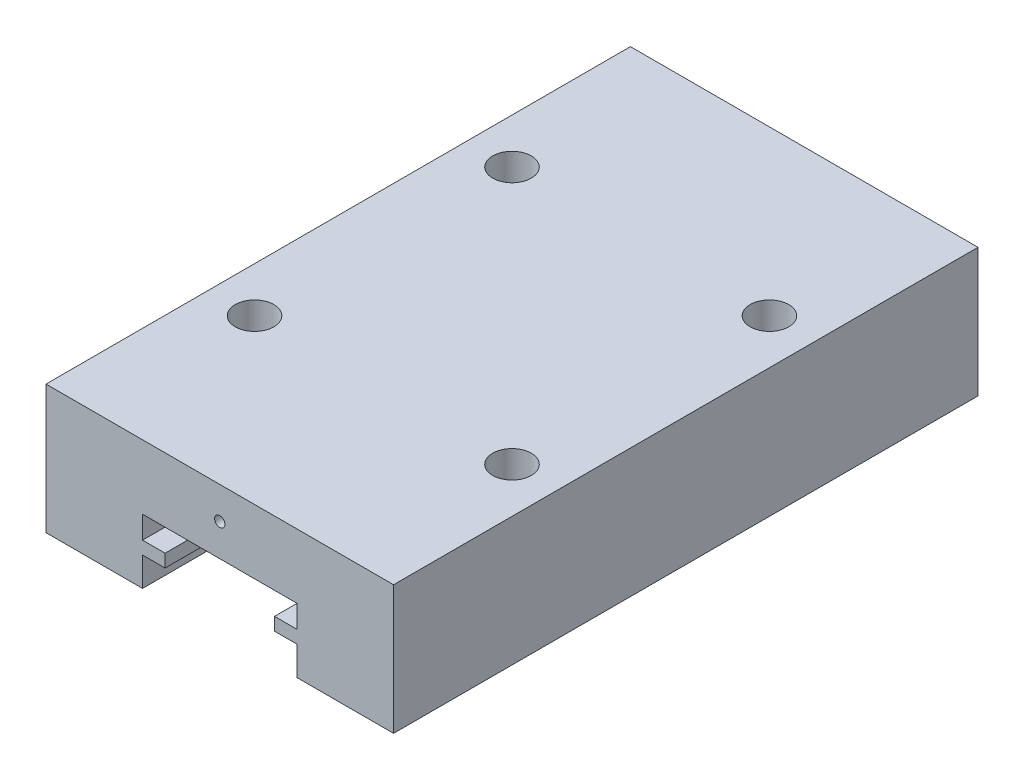
from build123d import *

# Parameters (mm, degrees)
DODANIE_WYCI_GNI_CIE1_DEPTH    = 45.4
OTWORY_USTALAJ_CE_1_0MM1_D     = 0.8
OTWORY_USTALAJ_CE_1_0MM1_DEPTH = 6.5
OTWORY_USTALAJ_CE_1_0MM1_TIP   = 0.240344248
OTWORY_USTALAJ_CE_1_0MM2_D     = 0.8
OTWORY_USTALAJ_CE_1_0MM2_DEPTH = 6.5
OTWORY_USTALAJ_CE_1_0MM2_TIP   = 0.240344248
F_3_0MM_DOWEL_HOLE1_D          = 3
F_3_0MM_DOWEL_HOLE1_DEPTH      = 3.5


with BuildPart() as part:
    # Szkic1 → Dodanie-wyciągnięcie1 (new body)
    with BuildSketch(Plane.XY):
        Polygon((7.5, 0), (7.5, 2.247882756), (9.25, 2.247882756), (9.25, 3.247882756), (7.5, 3.247882756), (7.5, 4.997882756), (19.5, 4.997882756), (19.5, 3.247882756), (17.75, 3.247882756), (17.75, 2.247882756), (19.5, 2.247882756), (19.5, 0), (27, 0), (27, 10), (0, 10), (0, 0), align=None)
    extrude(amount=DODANIE_WYCI_GNI_CIE1_DEPTH)

    # Otwory ustalające Ø1.0mm1
    with Locations(Plane.XY.offset(45.4)):
        with Locations((13.5, 7.5)):
            Hole(OTWORY_USTALAJ_CE_1_0MM1_D / 2, depth=OTWORY_USTALAJ_CE_1_0MM1_DEPTH)
            with Locations((0, 0, -(OTWORY_USTALAJ_CE_1_0MM1_DEPTH + OTWORY_USTALAJ_CE_1_0MM1_TIP / 2))):  # 118° drill point
                Cone(0, OTWORY_USTALAJ_CE_1_0MM1_D / 2, OTWORY_USTALAJ_CE_1_0MM1_TIP, mode=Mode.SUBTRACT)

    # Otwory ustalające Ø1.0mm2
    with Locations(Plane(origin=(0, 0, 0), x_dir=(-1, 0, 0), z_dir=(0, 0, -1))):
        with Locations((-13.5, 7.5)):
            Hole(OTWORY_USTALAJ_CE_1_0MM2_D / 2, depth=OTWORY_USTALAJ_CE_1_0MM2_DEPTH)
            with Locations((0, 0, -(OTWORY_USTALAJ_CE_1_0MM2_DEPTH + OTWORY_USTALAJ_CE_1_0MM2_TIP / 2))):  # 118° drill point
                Cone(0, OTWORY_USTALAJ_CE_1_0MM2_D / 2, OTWORY_USTALAJ_CE_1_0MM2_TIP, mode=Mode.SUBTRACT)

    # Ø3.0mm Dowel Hole1
    with Locations(Plane(origin=(0, 10, 0), x_dir=(1, 0, 0), z_dir=(0, 1, 0))):
        with Locations((3.5, -32.7), (23.5, -32.7), (23.5, -12.7), (3.5, -12.7)):
            Hole(F_3_0MM_DOWEL_HOLE1_D / 2, depth=F_3_0MM_DOWEL_HOLE1_DEPTH)


solid = part.part
